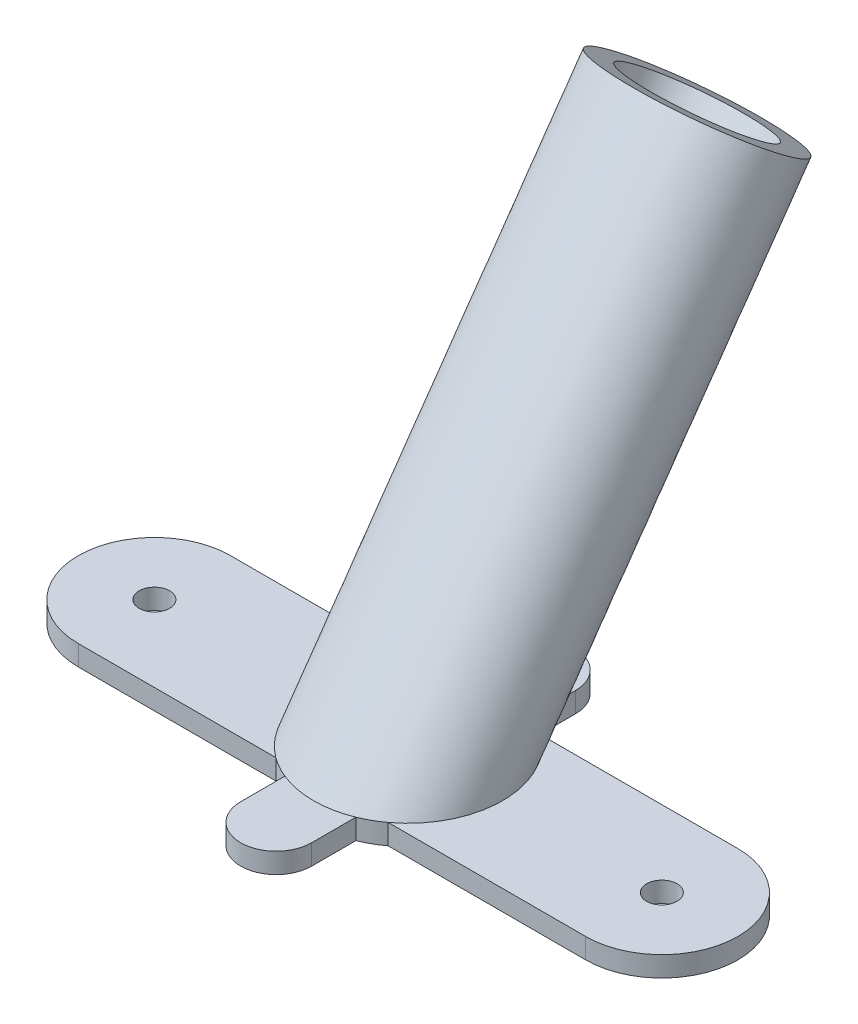
from build123d import *

# Parameters (mm, degrees)
CROQUIS1_R                 = 9.325
CROQUIS1_R_2               = 6.835
CROQUIS11_R                = 1.5
SALIENTE_EXTRUIR1_DEPTH    = 2
CORTAR_EXTRUIR2_DEPTH      = 69.96775808
CORTAR_EXTRUIR2_DEPTH_BACK = 69.96775808


with BuildPart() as part:
    # Barrer1: sweep along a path in Croquis6
    with BuildLine(Plane(origin=(0, 0, 0), x_dir=(0, 0, -1), z_dir=(1, 0, 0))) as barrer1_path:
        Line((9.345393917, 0), (40.892097916, 45.053362436))
    # Croquis1 → Barrer1 (sweep)
    with BuildSketch(Plane(origin=(0, 0, 0), x_dir=(1, 0, 0), z_dir=(0, 1, 0))):
        Circle(CROQUIS1_R)
        Circle(CROQUIS1_R_2, mode=Mode.SUBTRACT)
    sweep(path=barrer1_path.line)

    # Croquis11 → Saliente-Extruir1 (add)
    with BuildSketch(Plane.XZ):
        with BuildLine():
            Line((-25, 7.5), (-5.54126565, 7.5))
            ThreePointArc((-5.54126565, 7.5), (-4.556629397, 8.135892916), (-3.5, 8.643241579))
            Line((-3.5, 8.643241579), (-3.5, 13))
            ThreePointArc((-3.5, 13), (0, 16.5), (3.5, 13))
            Line((3.5, 13), (3.5, 8.643241579))
            ThreePointArc((3.5, 8.643241579), (4.556629397, 8.135892916), (5.54126565, 7.5))
            Line((5.54126565, 7.5), (25, 7.5))
            ThreePointArc((25, 7.5), (32.5, 0), (25, -7.5))
            Line((25, -7.5), (5.54126565, -7.5))
            ThreePointArc((5.54126565, -7.5), (4.556629397, -8.135892916), (3.5, -8.643241579))
            Line((3.5, -8.643241579), (3.5, -13))
            ThreePointArc((3.5, -13), (0, -16.5), (-3.5, -13))
            Line((-3.5, -13), (-3.5, -8.643241579))
            ThreePointArc((-3.5, -8.643241579), (-4.556629397, -8.135892916), (-5.54126565, -7.5))
            Line((-5.54126565, -7.5), (-25, -7.5))
            ThreePointArc((-25, -7.5), (-32.5, 0), (-25, 7.5))
        make_face()
        with Locations(Location((-25, 0, 0), (0, 0, 270))):
            Circle(CROQUIS11_R, mode=Mode.SUBTRACT)
        with Locations(Location((25, 0, 0), (0, 0, 270))):
            Circle(CROQUIS11_R, mode=Mode.SUBTRACT)
    extrude(amount=SALIENTE_EXTRUIR1_DEPTH)

    # Croquis13 → Cortar-Extruir2 (cut, two sides: drawn at the far end of the back side and taken through both)
    with BuildSketch(Plane(origin=(0, 0, 0), x_dir=(0, 0, -1), z_dir=(1, 0, 0)).offset(-CORTAR_EXTRUIR2_DEPTH_BACK)):
        Polygon((22.221703999, 45.053362436), (40.871703999, 31.994491848), (40.871703999, 45.053362436), align=None)
    extrude(amount=CORTAR_EXTRUIR2_DEPTH + CORTAR_EXTRUIR2_DEPTH_BACK, mode=Mode.SUBTRACT)


solid = part.part
